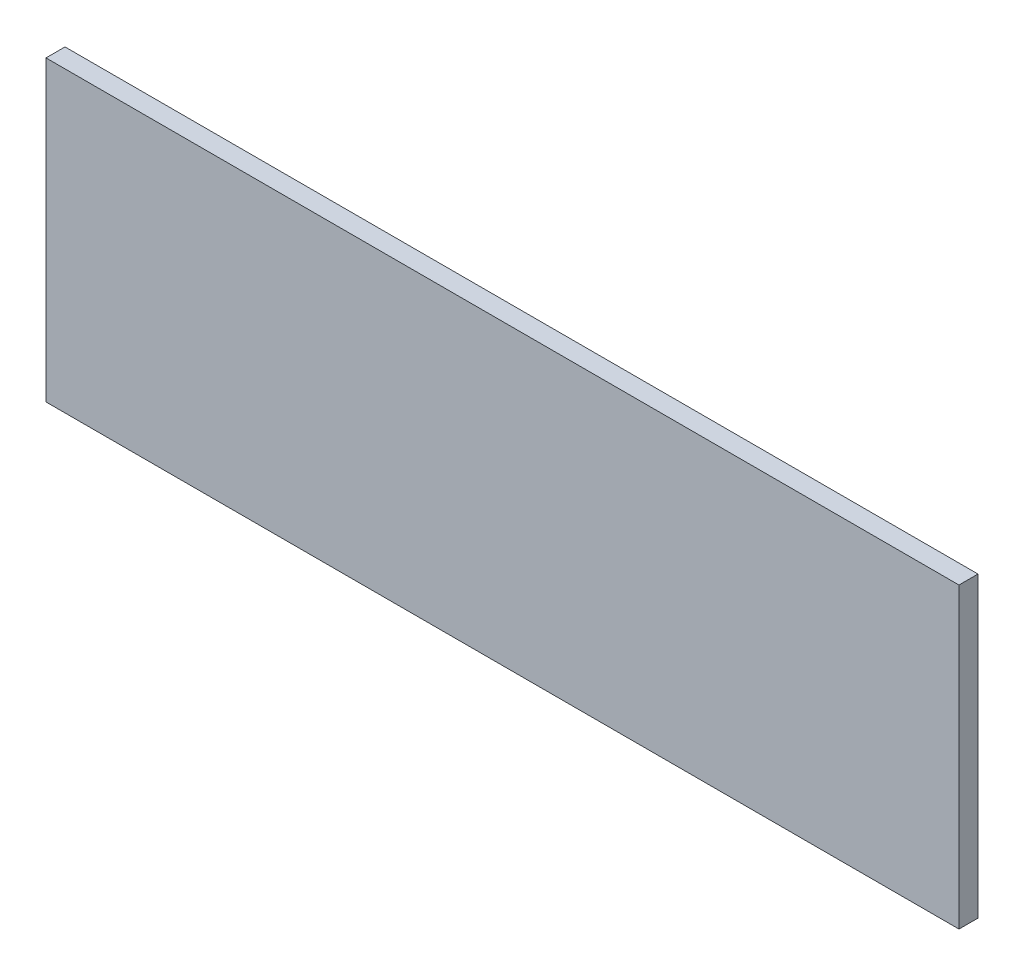
from build123d import *

# Parameters (mm, degrees)
SKETCH1_W           = 144
SKETCH1_H           = 47
BOSS_EXTRUDE1_DEPTH = 3


with BuildPart() as part:
    # Sketch1 → Boss-Extrude1 (new body)
    with BuildSketch(Plane.XY):
        with Locations((87.644313661, 219.681377026)):
            Rectangle(SKETCH1_W, SKETCH1_H)
    extrude(amount=BOSS_EXTRUDE1_DEPTH)


solid = part.part
